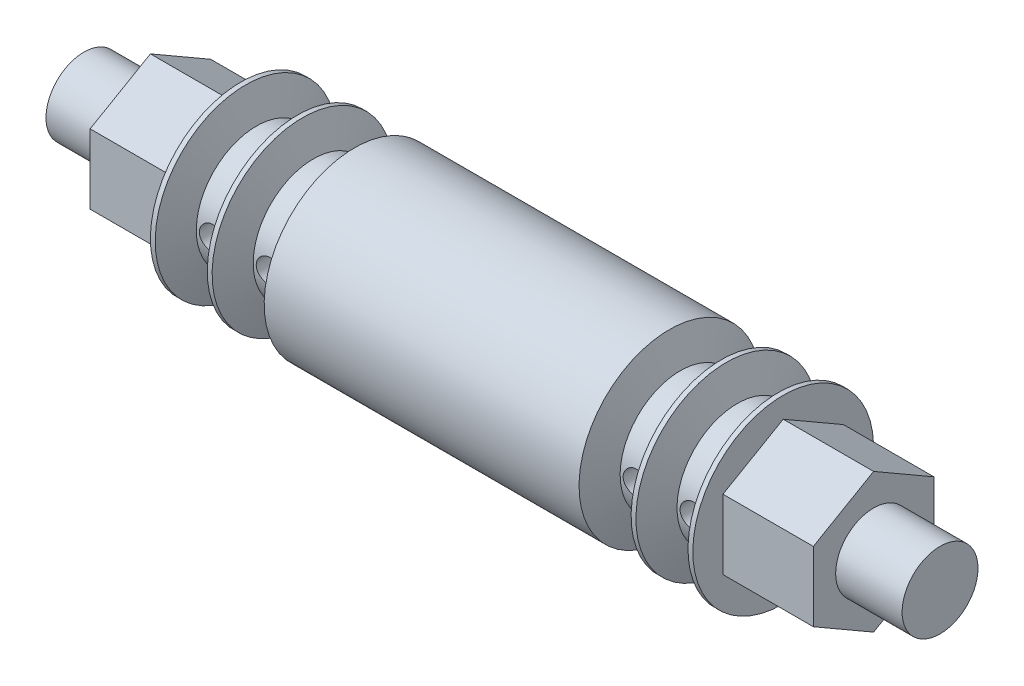
from build123d import *

# Parameters (mm, degrees)
BOSS_EXTRUDE4_DEPTH = 9.525
SKETCH6_R           = 1.27
CUT_EXTRUDE1_DEPTH  = 48.068686512


with BuildPart() as part:
    # Sketch1 → Revolve1 (revolve)
    with BuildSketch(Plane.XY, mode=Mode.PRIVATE) as revolve1_sk:
        Polygon((-28.067, 9.525), (-26.911394506, 6.35), (-23.736394506, 6.35), (-22.580789012, 9.525), (-22.072789012, 9.525), (-20.917183519, 6.35), (-17.742183519, 6.35), (-16.586578025, 9.525), (0, 9.525), (0, 0), (-28.575, 0), (-38.1, 0), (-45.1, 0), (-45.1, 4), (-38.1, 4), (-38.1, 4.254), (-28.575, 4.254), (-28.575, 9.525), align=None)
    revolve1 = revolve(revolve1_sk.sketch.rotate(Axis((-38.1, 0, 0), (1, 0, 0)), 180), axis=Axis((-38.1, 0, 0), (1, 0, 0)))

    # Sketch4 → Boss-Extrude4 (add)
    with BuildSketch(Plane.ZY.offset(28.575)):
        Polygon((0, 7.332348419), (-6.35, 3.666174209), (-6.35, -3.666174209), (0, -7.332348419), (6.35, -3.666174209), (6.35, 3.666174209), align=None)
    boss_extrude4 = extrude(amount=BOSS_EXTRUDE4_DEPTH)

    # Sketch6 → Cut-Extrude1 (cut, symmetric)
    with BuildSketch(Plane.XY):
        with Locations((-25.323894506, 0)):
            Circle(SKETCH6_R)
        with Locations((-19.329683519, 0)):
            Circle(SKETCH6_R)
    cut_extrude1 = extrude(amount=CUT_EXTRUDE1_DEPTH, both=True, mode=Mode.SUBTRACT)

    # Mirror1: Revolve1, Boss-Extrude4, Cut-Extrude1 across plane
    add(revolve1.mirror(Plane(origin=(0, 0, 0), x_dir=(0, 0, 1), z_dir=(1, 0, 0))))
    add(boss_extrude4.mirror(Plane(origin=(0, 0, 0), x_dir=(0, 0, 1), z_dir=(1, 0, 0))))
    add(cut_extrude1.mirror(Plane(origin=(0, 0, 0), x_dir=(0, 0, 1), z_dir=(1, 0, 0))), mode=Mode.SUBTRACT)


solid = part.part
